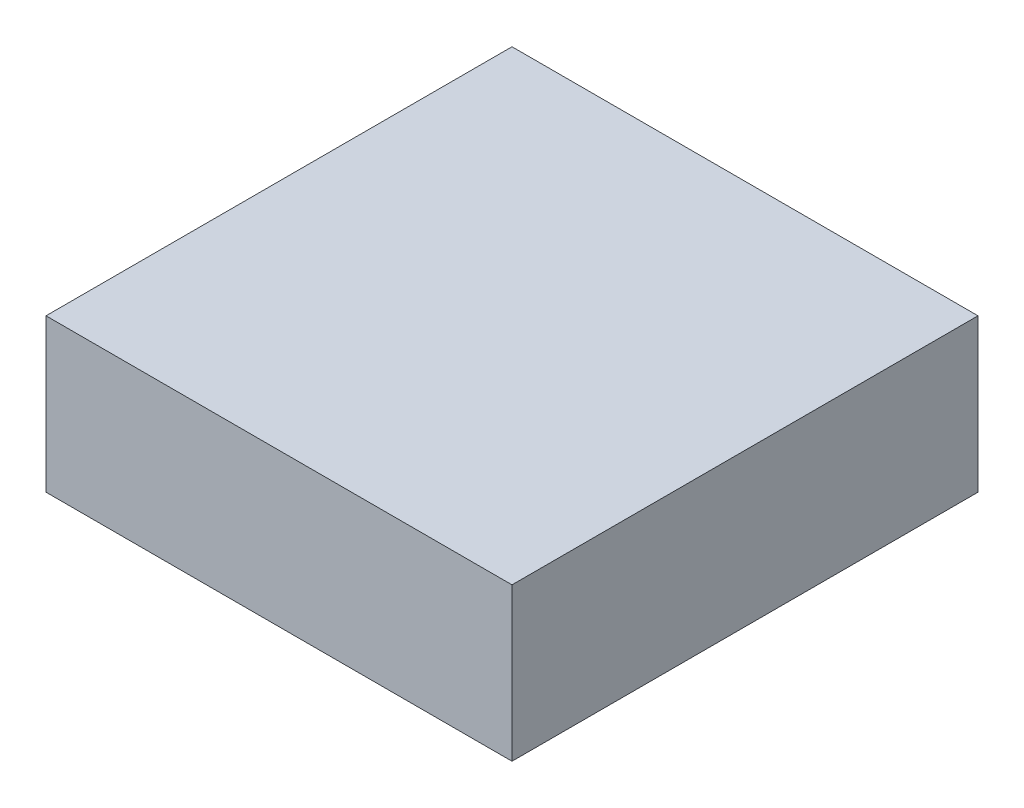
from build123d import *

# Parameters (mm, degrees)
SKETCH1_W           = 6.1
SKETCH1_H           = 6.1
BOSS_EXTRUDE1_DEPTH = 2


with BuildPart() as part:
    # Sketch1 → Boss-Extrude1 (new body)
    with BuildSketch(Plane(origin=(0, 0, 0), x_dir=(1, 0, 0), z_dir=(0, 1, 0))):
        Rectangle(SKETCH1_W, SKETCH1_H)
    extrude(amount=BOSS_EXTRUDE1_DEPTH)


solid = part.part
